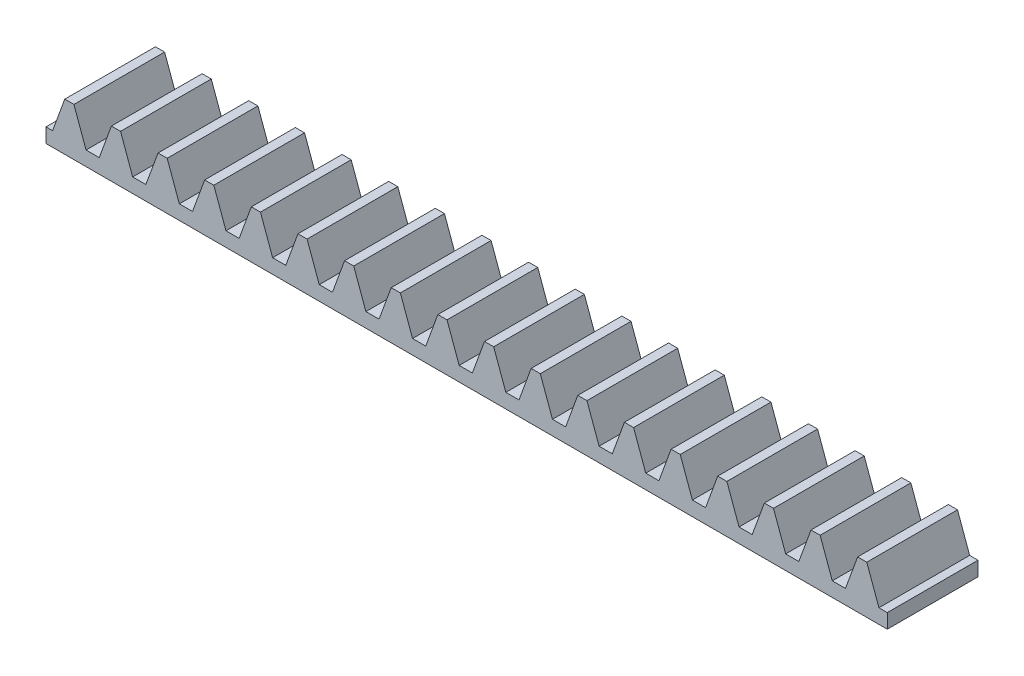
from build123d import *

# Parameters (mm, degrees)
BLANKSKE_W        = 51
BLANKSKE_H        = 2.9
BLANK_DEPTH       = 5.5
TOOTHCUTSIM_DEPTH = 52.377621588
TEETHCUTS_COUNT   = 19
TEETHCUTS_PITCH   = 2.827433385


with BuildPart() as part:
    # BlankSke → Blank (new body)
    with BuildSketch(Plane.XY):
        with Locations((25.5, 1.45)):
            Rectangle(BLANKSKE_W, BLANKSKE_H)
    extrude(amount=-BLANK_DEPTH)

    # TooCutSkeSim → ToothCutSim (cut, through all)
    with BuildSketch(Plane.XY):
        Polygon((0.399391833, 0.875), (-0.399391833, 0.875), (-1.145676401, 2.9254), (1.145676401, 2.9254), align=None)
    toothcutsim = extrude(amount=-TOOTHCUTSIM_DEPTH, mode=Mode.SUBTRACT)

    # TeethCuts: ToothCutSim ×19
    with Locations(*[(i * TEETHCUTS_PITCH, 0, 0) for i in range(1, TEETHCUTS_COUNT)]):
        add(toothcutsim, mode=Mode.SUBTRACT)


solid = part.part
